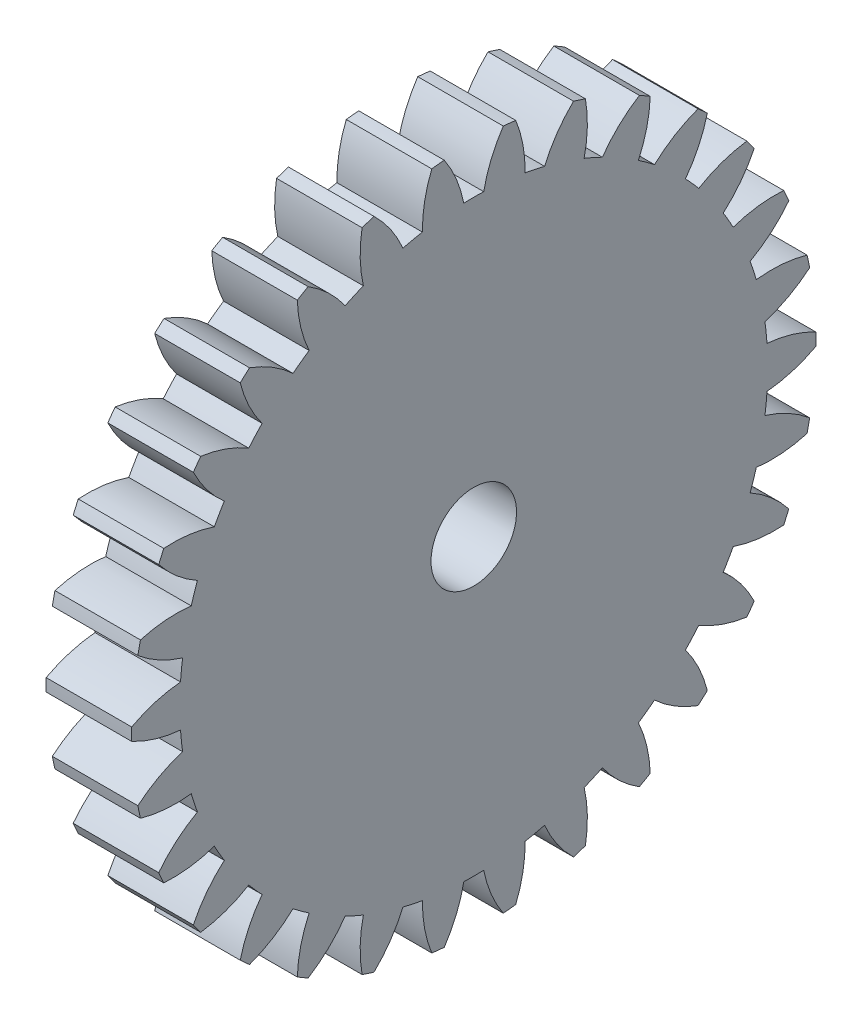
from build123d import *

# Parameters (mm, degrees)
BASPROSKE_W      = 2
BASPROSKE_H      = 8
TOOTHCUT_DEPTH   = 12.489125293
TEETHCUTS_COUNT  = 30
TEETHCUTS_ANGLE  = 348
HUBNEAONESKE_R   = 2.5
HUBNEARONE_DEPTH = 3.0000508
BORSKE_R         = 1
BORE_DEPTH       = 5.0000508


with BuildPart() as part:
    # BasProSke → Base-Revolve (revolve)
    with BuildSketch(Plane(origin=(0, 0, 0), x_dir=(1, 0, 0), z_dir=(0, 1, 0)), mode=Mode.PRIVATE) as base_revolve_sk:
        with Locations((1, 4)):
            Rectangle(BASPROSKE_W, BASPROSKE_H)
    revolve(base_revolve_sk.sketch.rotate(Axis((-10, 0, 0), (1, 0, 0)), 180), axis=Axis((-10, 0, 0), (1, 0, 0)))

    # TooCutSke → ToothCut (cut, through all)
    with BuildSketch(Plane(origin=(0, 0, 0), x_dir=(0, 0, -1), z_dir=(1, 0, 0))):
        with BuildLine():
            ThreePointArc((0.233102578, 6.87004652), (0, 6.874), (-0.233102578, 6.87004652))
            ThreePointArc((-0.233102578, 6.87004652), (-0.41229689, 7.456465027), (-0.706981715, 7.994199273))
            ThreePointArc((-0.706981715, 7.994199273), (0, 8.0254), (0.706981715, 7.994199273))
            ThreePointArc((0.706981715, 7.994199273), (0.41229689, 7.456465027), (0.233102578, 6.87004652))
        make_face()
    toothcut = extrude(amount=TOOTHCUT_DEPTH, mode=Mode.SUBTRACT)

    # TeethCuts: ToothCut ×30 about axis
    teethcuts_axis = Axis((-10, 0, 0), (1, 0, 0))
    for i in range(1, TEETHCUTS_COUNT):
        add(toothcut.rotate(teethcuts_axis, i * TEETHCUTS_ANGLE / (TEETHCUTS_COUNT - 1)), mode=Mode.SUBTRACT)

    # HubNeaOneSke → HubNearOne (add)
    with BuildSketch(Plane.ZY):
        with Locations(Location((0, 0, 0), (0, 0, 180))):
            Circle(HUBNEAONESKE_R)
    extrude(amount=HUBNEARONE_DEPTH)

    # BorSke → Bore (cut, symmetric)
    with BuildSketch(Plane(origin=(0, 0, 0), x_dir=(0, 0, -1), z_dir=(1, 0, 0))):
        with Locations(Location((0, 0, 0), (0, 0, 180))):
            Circle(BORSKE_R)
    extrude(amount=BORE_DEPTH, both=True, mode=Mode.SUBTRACT)


solid = part.part
